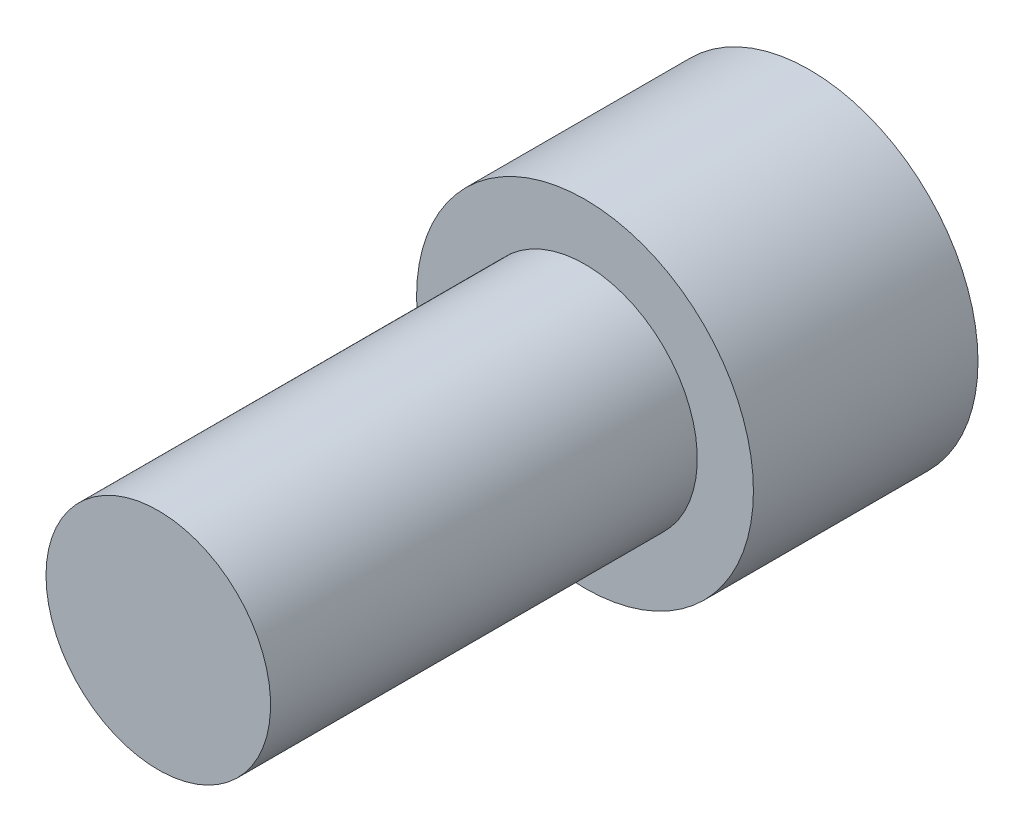
from build123d import *

# Parameters (mm, degrees)
SKETCH1_R           = 7.5
BOSS_EXTRUDE1_DEPTH = 250
SKETCH2_R           = 5
CUT_EXTRUDE1_DEPTH  = 10
SKETCH3_R           = 9.435011435
SKETCH3_R_2         = 5
CUT_EXTRUDE2_DEPTH  = 19
SKETCH5_R           = 25.765699078
CUT_EXTRUDE3_DEPTH  = 221


with BuildPart() as part:
    # Sketch1 → Boss-Extrude1 (new body)
    with BuildSketch(Plane.XY):
        Circle(SKETCH1_R)
    extrude(amount=BOSS_EXTRUDE1_DEPTH)

    # Sketch2 → Cut-Extrude1 (cut)
    with BuildSketch(Plane.XY):
        Circle(SKETCH2_R)
    extrude(amount=CUT_EXTRUDE1_DEPTH, mode=Mode.SUBTRACT)

    # Sketch3 → Cut-Extrude2 (cut)
    with BuildSketch(Plane(origin=(0, 0, 10), x_dir=(-1, 0, 0), z_dir=(0, 0, -1))):
        Circle(SKETCH3_R)
        Circle(SKETCH3_R_2, mode=Mode.SUBTRACT)
    extrude(amount=-CUT_EXTRUDE2_DEPTH, mode=Mode.SUBTRACT)


with BuildPart() as cut_extrude2_piece_1:
    # of the separate pieces the step leaves, piece 1, a body of its own (cut_extrude2_pieces)
    add(part.part.solids().sort_by_distance((7.5, 0, 29))[0])

    # Sketch5 → Cut-Extrude3 (cut)
    with BuildSketch(Plane(origin=(0, 0, 29), x_dir=(-1, 0, 0), z_dir=(0, 0, -1))):
        Circle(SKETCH5_R)
    extrude(amount=-CUT_EXTRUDE3_DEPTH, mode=Mode.SUBTRACT)


with BuildPart() as cut_extrude2_piece_2:
    # of the separate pieces the step leaves, piece 2, a body of its own (cut_extrude2_pieces)
    add(part.part.solids().sort_by_distance((7.5, 0, 0))[0])


solid = Compound([cut_extrude2_piece_1.part, cut_extrude2_piece_2.part])
